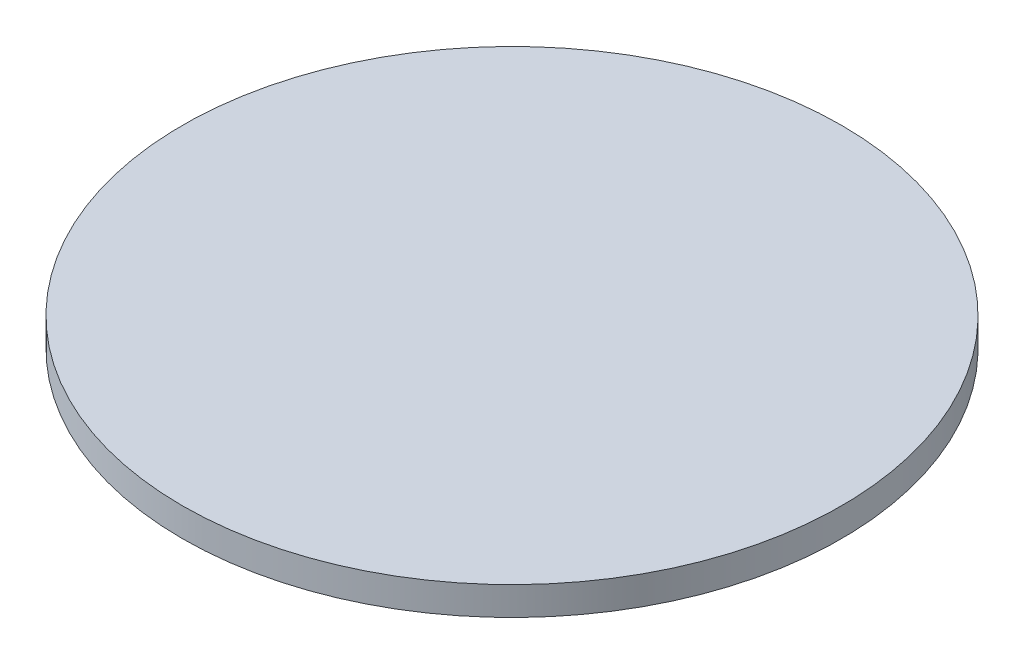
from build123d import *

# Parameters (mm, degrees)
SKETCH1_R           = 23.495
BOSS_EXTRUDE1_DEPTH = 2.032


with BuildPart() as part:
    # Sketch1 → Boss-Extrude1 (new body)
    with BuildSketch(Plane(origin=(0, 0, 0), x_dir=(1, 0, 0), z_dir=(0, 1, 0))):
        with Locations(Location((0, 0, 0), (0, 0, 270))):
            Circle(SKETCH1_R)
    extrude(amount=BOSS_EXTRUDE1_DEPTH)


solid = part.part
